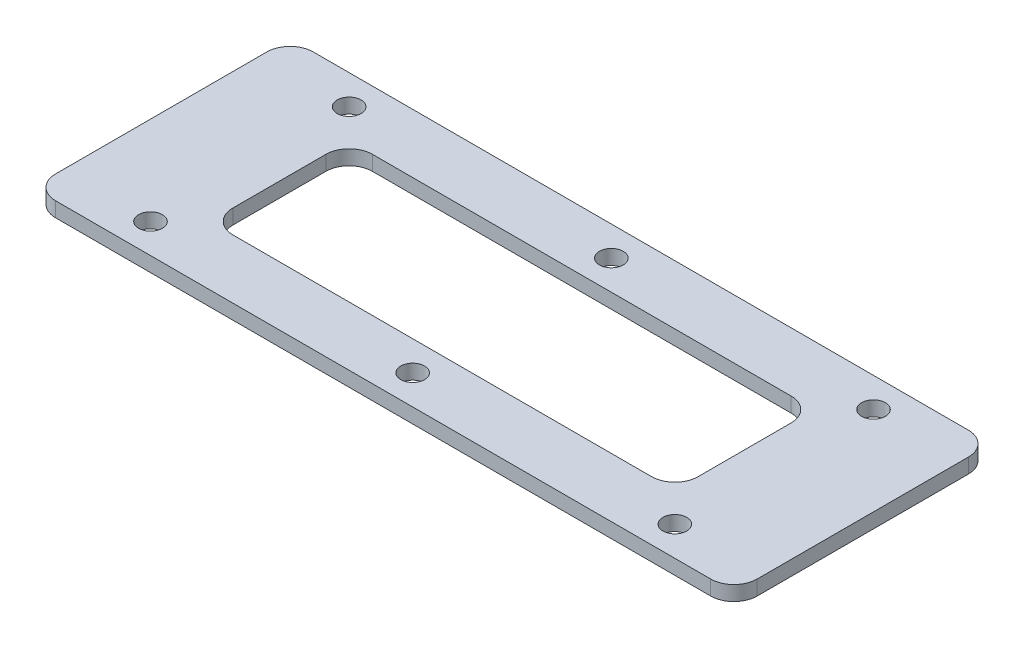
from build123d import *

# Parameters (mm, degrees)
SKETCH1_R           = 2.5527
BOSS_EXTRUDE1_DEPTH = 3.175


with BuildPart() as part:
    # Sketch1 → Boss-Extrude1 (new body)
    with BuildSketch(Plane(origin=(0, 0, 0), x_dir=(1, 0, 0), z_dir=(0, 1, 0))):
        with BuildLine():
            Line((-75.4, 22.7), (-75.4, 0))
            Line((-75.4, 0), (-75.4, -22.7))
            ThreePointArc((-75.4, -22.7), (-73.935533906, -26.235533906), (-70.4, -27.7))
            Line((-70.4, -27.7), (70.4, -27.7))
            ThreePointArc((70.4, -27.7), (73.935533906, -26.235533906), (75.4, -22.7))
            Line((75.4, -22.7), (75.4, 0))
            Line((75.4, 0), (75.4, 22.7))
            ThreePointArc((75.4, 22.7), (73.935533906, 26.235533906), (70.4, 27.7))
            Line((70.4, 27.7), (-70.4, 27.7))
            ThreePointArc((-70.4, 27.7), (-73.935533906, 26.235533906), (-75.4, 22.7))
        make_face()
        with Locations(Location((-56.35, -21.35, 0), (0, 0, 270))):
            Circle(SKETCH1_R, mode=Mode.SUBTRACT)
        with Locations(Location((0, -21.35, 0), (0, 0, 270))):
            Circle(SKETCH1_R, mode=Mode.SUBTRACT)
        with Locations(Location((56.35, -21.35, 0), (0, 0, 270))):
            Circle(SKETCH1_R, mode=Mode.SUBTRACT)
        with Locations(Location((56.35, 21.35, 0), (0, 0, 270))):
            Circle(SKETCH1_R, mode=Mode.SUBTRACT)
        with Locations(Location((0, 21.35, 0), (0, 0, 270))):
            Circle(SKETCH1_R, mode=Mode.SUBTRACT)
        with Locations(Location((-56.35, 21.35, 0), (0, 0, 270))):
            Circle(SKETCH1_R, mode=Mode.SUBTRACT)
        with BuildLine():
            Line((45, 15), (-45, 15))
            ThreePointArc((-45, 15), (-48.535533906, 13.535533906), (-50, 10))
            Line((-50, 10), (-50, -10))
            ThreePointArc((-50, -10), (-48.535533906, -13.535533906), (-45, -15))
            Line((-45, -15), (45, -15))
            ThreePointArc((45, -15), (48.535533906, -13.535533906), (50, -10))
            Line((50, -10), (50, 10))
            ThreePointArc((50, 10), (48.535533906, 13.535533906), (45, 15))
        make_face(mode=Mode.SUBTRACT)
    extrude(amount=BOSS_EXTRUDE1_DEPTH)


solid = part.part
